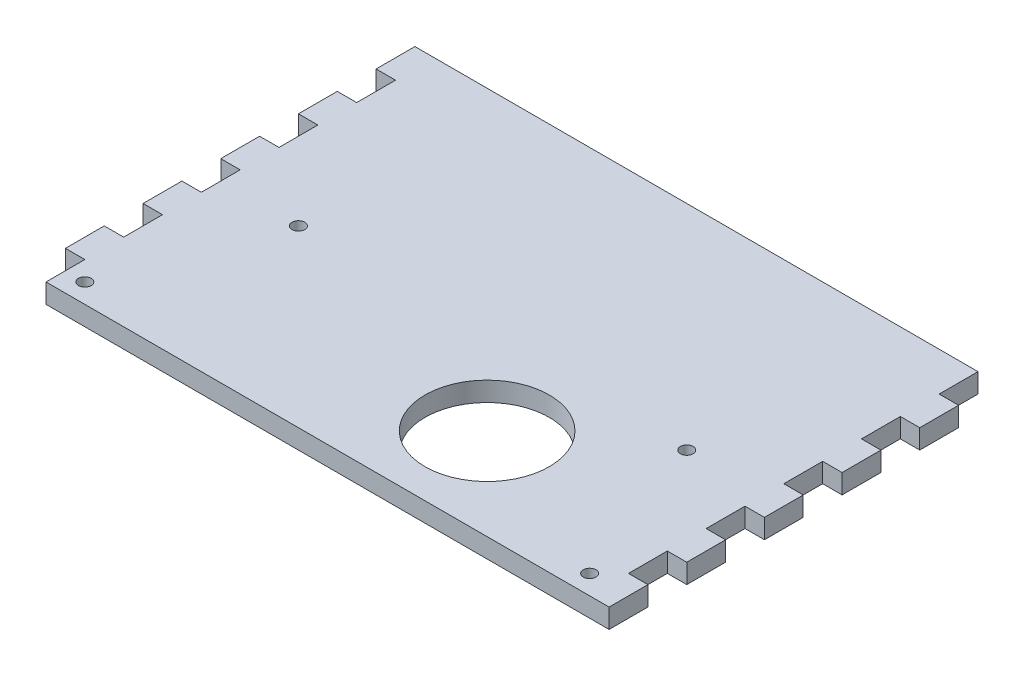
from build123d import *

# Parameters (mm, degrees)
SKETCH2_R           = 2.0828
SKETCH2_R_2         = 20.32
BOSS_EXTRUDE1_DEPTH = 6.35


with BuildPart() as part:
    # Sketch2 → Boss-Extrude1 (new body)
    with BuildSketch(Plane(origin=(0, 0, 0), x_dir=(1, 0, 0), z_dir=(0, 1, 0))):
        Polygon((15.875, 0), (15.875, 12.7), (9.525, 12.7), (9.525, 25.4), (15.875, 25.4), (15.875, 38.1), (9.525, 38.1), (9.525, 50.8), (15.875, 50.8), (15.875, 63.5), (9.525, 63.5), (9.525, 76.2), (15.875, 76.2), (15.875, 88.9), (9.525, 88.9), (9.525, 101.6), (15.875, 101.6), (15.875, 114.3), (9.525, 114.3), (9.525, 127), (15.875, 127), (193.675, 127), (193.675, 114.3), (200.025, 114.3), (200.025, 101.6), (193.675, 101.6), (193.675, 88.9), (200.025, 88.9), (200.025, 76.2), (193.675, 76.2), (193.675, 63.5), (200.025, 63.5), (200.025, 50.8), (193.675, 50.8), (193.675, 38.1), (200.025, 38.1), (200.025, 25.4), (193.675, 25.4), (193.675, 12.7), (200.025, 12.7), (200.025, 0), align=None)
        with Locations(Location((41.275, 57.15, 0), (0, 0, 270))):
            Circle(SKETCH2_R, mode=Mode.SUBTRACT)
        with Locations(Location((168.275, 57.15, 0), (0, 0, 90))):
            Circle(SKETCH2_R, mode=Mode.SUBTRACT)
        with Locations(Location((130.175, 29.972, 0), (0, 0, 270))):
            Circle(SKETCH2_R_2, mode=Mode.SUBTRACT)
        with Locations(Location((22.225, 6.35, 0), (0, 0, 270))):
            Circle(SKETCH2_R, mode=Mode.SUBTRACT)
        with Locations(Location((187.325, 6.35, 0), (0, 0, 90))):
            Circle(SKETCH2_R, mode=Mode.SUBTRACT)
    extrude(amount=BOSS_EXTRUDE1_DEPTH)


solid = part.part
